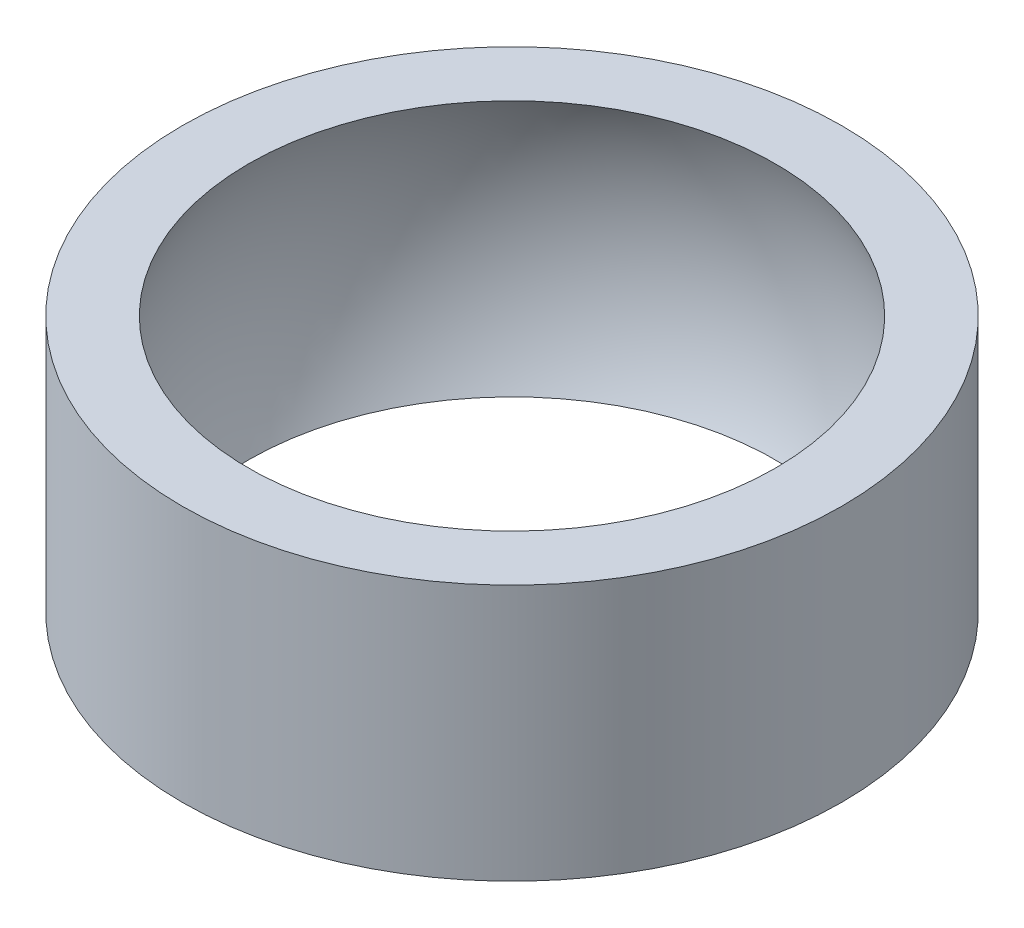
from build123d import *


with BuildPart() as part:
    # Esquisse1 → Révolution1 (revolve)
    with BuildSketch(Plane.XY):
        with BuildLine():
            Line((-3.596873642, 1.75), (-4.5, 1.75))
            Line((-4.5, 1.75), (-4.5, -1.75))
            Line((-4.5, -1.75), (-3.596873642, -1.75))
            ThreePointArc((-3.596873642, -1.75), (-4, 0), (-3.596873642, 1.75))
        make_face()
    revolve(axis=Axis((0, 2.563616521, 0), (0, -1, 0)))


solid = part.part
